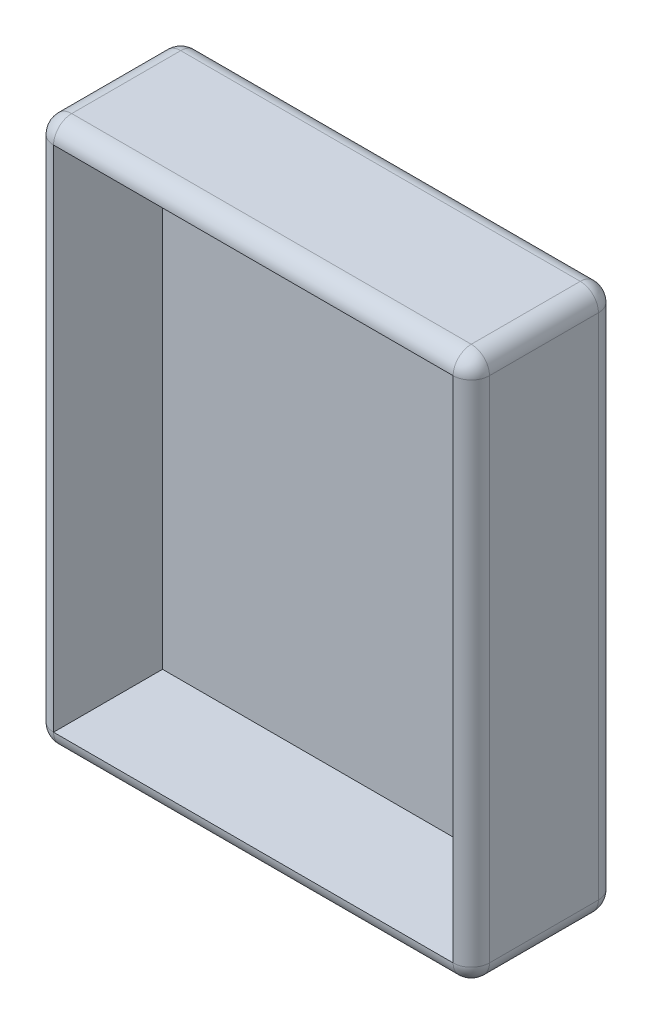
from build123d import *

# Parameters (mm, degrees)
SKETCH1_W           = 120
SKETCH1_H           = 150
BOSS_EXTRUDE1_DEPTH = 40
FILLET2_R           = 5
SKETCH2_W           = 110
SKETCH2_H           = 140
CUT_EXTRUDE1_DEPTH  = 30


with BuildPart() as part:
    # Sketch1 → Boss-Extrude1 (new body)
    with BuildSketch(Plane.XY):
        with Locations((-27.929641074, 46.164250059)):
            Rectangle(SKETCH1_W, SKETCH1_H)
    extrude(amount=BOSS_EXTRUDE1_DEPTH)

    # Fillet2
    fillet2_edges = [part.edges().sort_by_distance(p)[0] for p in [
        (-87.929641074, 46.164250059, 40),
        (-27.929641074, -28.835749941, 40),
        (32.070358926, 46.164250059, 40),
        (-27.929641074, -28.835749941, 0),
        (-87.929641074, 46.164250059, 0),
        (-27.929641074, 121.164250059, 0),
        (32.070358926, 46.164250059, 0),
        (-27.929641074, 121.164250059, 40),
        (32.070358926, -28.835749941, 20),
        (-87.929641074, -28.835749941, 20),
        (-87.929641074, 121.164250059, 20),
        (32.070358926, 121.164250059, 20),
    ]]
    fillet(fillet2_edges, radius=FILLET2_R)

    # Sketch2 → Cut-Extrude1 (cut)
    with BuildSketch(Plane.XY.offset(40)):
        with Locations((-27.929641074, 46.164250059)):
            Rectangle(SKETCH2_W, SKETCH2_H)
    extrude(amount=-CUT_EXTRUDE1_DEPTH, mode=Mode.SUBTRACT)


solid = part.part
